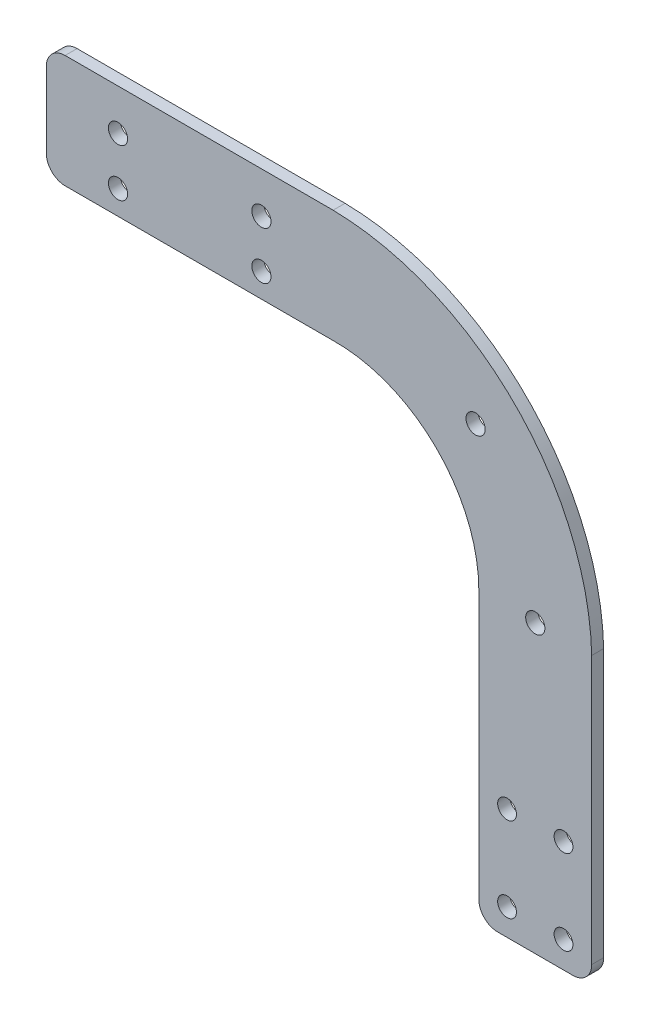
from build123d import *

# Parameters (mm, degrees)
SKETCH1_W           = 76.2
SKETCH1_H           = 30
BOSS_EXTRUDE1_DEPTH = 3.175
BOSS_EXTRUDE2_DEPTH = 3.175
FILLET1_R           = 5
SKETCH5_R           = 2.5
CUT_EXTRUDE2_DEPTH  = 168.692302315
SKETCH6_R           = 2.55
CUT_EXTRUDE3_DEPTH  = 168.692302315
SKETCH7_R           = 2.55
CUT_EXTRUDE4_DEPTH  = 10


with BuildPart() as part:
    # Sketch1 → Boss-Extrude1 (new body)
    with BuildSketch(Plane.XY):
        Rectangle(SKETCH1_W, SKETCH1_H)
    extrude(amount=BOSS_EXTRUDE1_DEPTH)

    # Sketch3 → Boss-Extrude2 (add)
    with BuildSketch(Plane(origin=(0, 0, 0), x_dir=(-1, 0, 0), z_dir=(0, 0, -1))):
        with BuildLine():
            ThreePointArc((-38.1, 15), (-86.132736854, -5.252023618), (-106.8175, -53.1))
            Line((-106.8175, -53.1), (-106.8175, -129.230992121))
            Line((-106.8175, -129.230992121), (-76.8175, -129.230992121))
            Line((-76.8175, -129.230992121), (-76.8175, -53.1))
            ThreePointArc((-76.8175, -53.1), (-65.439370351, -25.940034949), (-38.1, -15))
            Line((-38.1, -15), (-38.1, 15))
        make_face()
    extrude(amount=-BOSS_EXTRUDE2_DEPTH)

    # Fillet1
    fillet1_edges = [part.edges().sort_by_distance(p)[0] for p in [
        (106.8175, -129.230992121, 1.5875),
        (76.8175, -129.230992121, 1.5875),
        (-38.1, 15, 1.5875),
        (-38.1, -15, 1.5875),
    ]]
    fillet(fillet1_edges, radius=FILLET1_R)

    # Sketch5 → Cut-Extrude2 (cut, through all)
    with BuildSketch(Plane.XY.offset(3.175)):
        with Locations((99.3175, -122.17)):
            Circle(SKETCH5_R)
        with Locations((84.3175, -122.17)):
            Circle(SKETCH5_R)
        with Locations((84.3175, -99.67)):
            Circle(SKETCH5_R)
        with Locations((99.3175, -99.67)):
            Circle(SKETCH5_R)
    extrude(amount=-CUT_EXTRUDE2_DEPTH, mode=Mode.SUBTRACT)

    # Sketch6 → Cut-Extrude3 (cut, through all)
    with BuildSketch(Plane(origin=(0, 0, 0), x_dir=(-1, 0, 0), z_dir=(0, 0, -1))):
        with Locations((-19.05, -8.6)):
            Circle(SKETCH6_R)
        with Locations((19.05, -8.6)):
            Circle(SKETCH6_R)
        with Locations((19.05, 4.1)):
            Circle(SKETCH6_R)
        with Locations((-19.05, 4.1)):
            Circle(SKETCH6_R)
    extrude(amount=-CUT_EXTRUDE3_DEPTH, mode=Mode.SUBTRACT)

    # Sketch7 → Cut-Extrude4 (cut)
    with BuildSketch(Plane(origin=(0, 0, 0), x_dir=(-1, 0, 0), z_dir=(0, 0, -1))):
        with Locations((-75.960370634, -15.248517141)):
            Circle(SKETCH7_R)
        with Locations((-91.8175, -53.1)):
            Circle(SKETCH7_R)
    extrude(amount=-CUT_EXTRUDE4_DEPTH, mode=Mode.SUBTRACT)


solid = part.part
